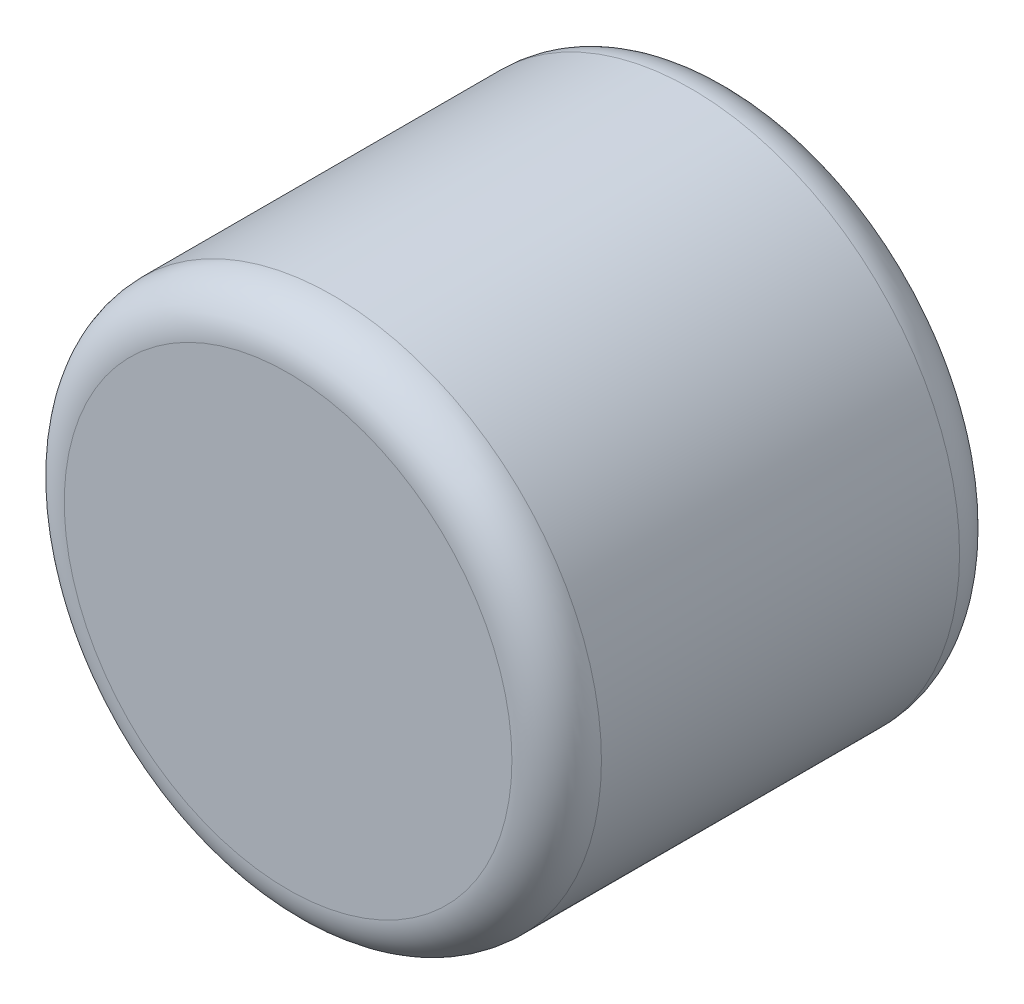
from build123d import *

# Parameters (mm, degrees)
SKETCH1_R           = 30
BOSS_EXTRUDE1_DEPTH = 25
FILLET1_R           = 5


with BuildPart() as part:
    # Sketch1 → Boss-Extrude1 (new, symmetric)
    with BuildSketch(Plane.XY):
        Circle(SKETCH1_R)
    extrude(amount=BOSS_EXTRUDE1_DEPTH, both=True)

    # Fillet1
    fillet1_edges = [part.edges().sort_by_distance(p)[0] for p in [
        (-30, 0, -25),
        (-30, 0, 25),
    ]]
    fillet(fillet1_edges, radius=FILLET1_R)


solid = part.part
